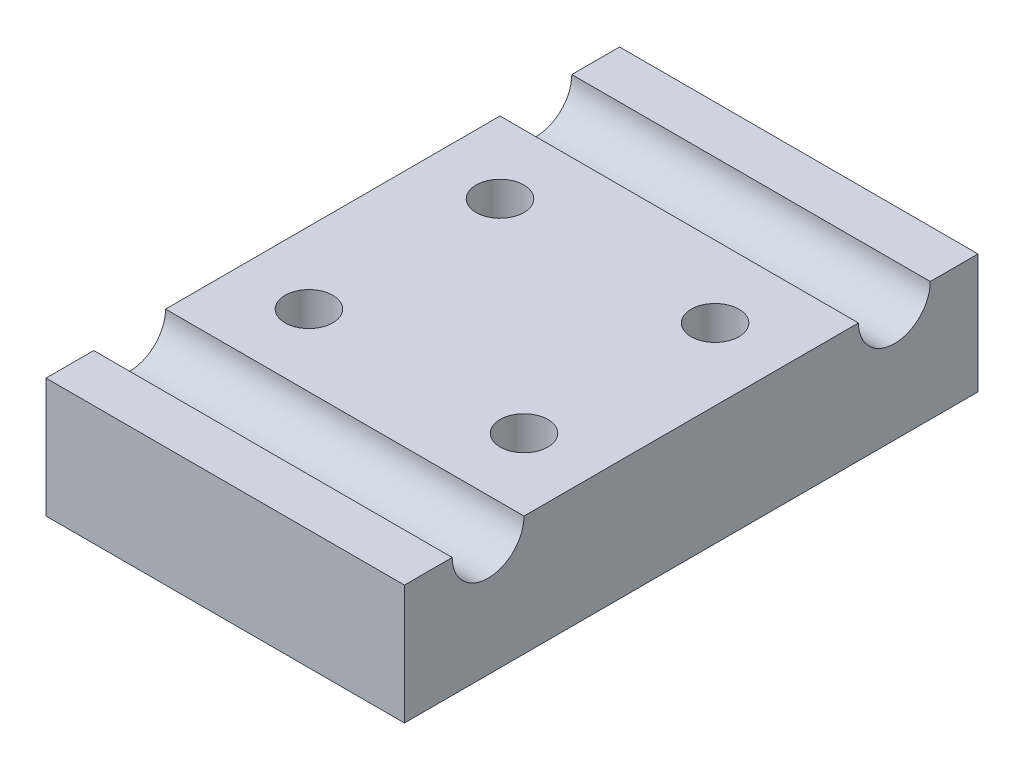
from build123d import *

# Parameters (mm, degrees)
SKETCH_1_W          = 30
SKETCH_1_H          = 10
EXTRUDE_1_DEPTH     = 48
SKETCH_3_R          = 3.005
CUT_EXTRUDE_1_DEPTH = 48
SKETCH_4_R          = 2
CUT_EXTRUDE_2_DEPTH = 58.480431453


with BuildPart() as part:
    # 草图1 → 凸台-拉伸1 (new body)
    with BuildSketch(Plane.XY):
        with Locations((15, 5)):
            Rectangle(SKETCH_1_W, SKETCH_1_H)
    extrude(amount=EXTRUDE_1_DEPTH)

    # 草图3 → 切除-拉伸1 (cut)
    with BuildSketch(Plane.ZY):
        with Locations((7, 10)):
            Circle(SKETCH_3_R)
        with Locations((41, 10)):
            Circle(SKETCH_3_R)
    extrude(amount=-CUT_EXTRUDE_1_DEPTH, mode=Mode.SUBTRACT)

    # 草图4 → 切除-拉伸2 (cut, through all)
    with BuildSketch(Plane(origin=(0, 10, 0), x_dir=(1, 0, 0), z_dir=(0, 1, 0))):
        with Locations(Location((24, -31.995, 0), (0, 0, 270))):
            Circle(SKETCH_4_R)
        with Locations(Location((6, -31.995, 0), (0, 0, 270))):
            Circle(SKETCH_4_R)
        with Locations(Location((24, -16.005, 0), (0, 0, 270))):
            Circle(SKETCH_4_R)
        with Locations(Location((6, -16.005, 0), (0, 0, 270))):
            Circle(SKETCH_4_R)
    extrude(amount=-CUT_EXTRUDE_2_DEPTH, mode=Mode.SUBTRACT)


solid = part.part
